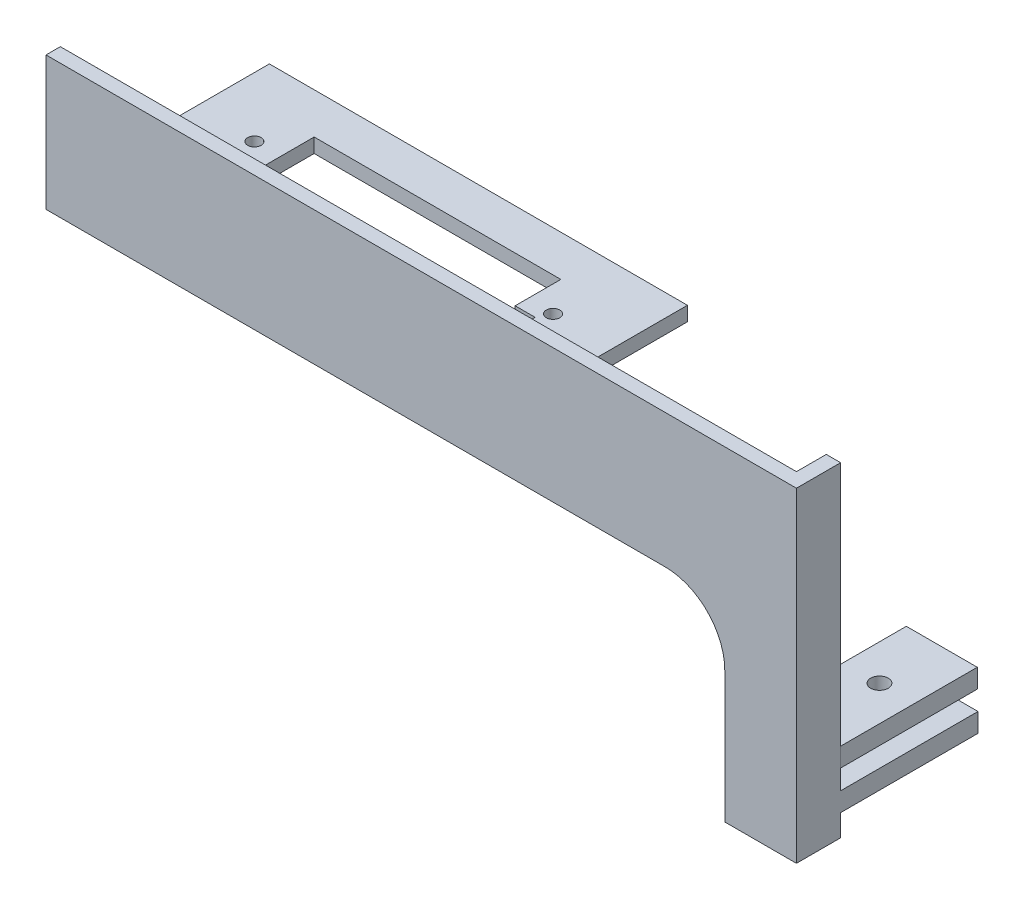
from build123d import *

# Parameters (mm, degrees)
SKETCH1_W               = 70
SKETCH1_H               = 35
BOSS_EXTRUDE1_DEPTH     = 2.4
SKETCH2_R               = 1.13
SKETCH2_W               = 40
SKETCH2_H               = 20
CUT_EXTRUDE1_DEPTH      = 2.4
SKETCH4_W               = 4
SKETCH4_H               = 6
CUT_EXTRUDE2_DEPTH      = 2.4
CUT_EXTRUDE3_DEPTH      = 134.373649476
CUT_EXTRUDE3_DEPTH_BACK = 134.373649476
SKETCH7_W               = 41.3
SKETCH7_H               = 21.3
SKETCH7_W_2             = 40
SKETCH7_H_2             = 20
BOSS_EXTRUDE2_DEPTH     = 2.4
SKETCH9_W               = 11.879910587
SKETCH9_H               = 3.175
SKETCH9_W_2             = 12
BOSS_EXTRUDE3_DEPTH     = 28
SKETCH10_R              = 1.4732
CUT_EXTRUDE4_DEPTH      = 30
FILLET1_R               = 10
SKETCH11_W              = 5
SKETCH11_H              = 54.4
BOSS_EXTRUDE4_DEPTH     = 2.4


with BuildPart() as part:
    # Sketch1 → Boss-Extrude1 (new body)
    with BuildSketch(Plane(origin=(0, 0, 0), x_dir=(1, 0, 0), z_dir=(0, 1, 0))):
        with Locations((92.522946176, 21.495750708)):
            Rectangle(SKETCH1_W, SKETCH1_H)
    extrude(amount=BOSS_EXTRUDE1_DEPTH)

    # Sketch2 → Cut-Extrude1 (cut)
    with BuildSketch(Plane(origin=(0, 2.4, 0), x_dir=(1, 0, 0), z_dir=(0, 1, 0))):
        with Locations(Location((67.522946176, 26.495750708, 0), (0, 0, 270))):
            Circle(SKETCH2_R)
        with Locations(Location((117.522946176, 26.495750708, 0), (0, 0, 270))):
            Circle(SKETCH2_R)
        with Locations(Location((117.522946176, 16.495750708, 0), (0, 0, 90))):
            Circle(SKETCH2_R)
        with Locations(Location((67.522946176, 16.495750708, 0), (0, 0, 90))):
            Circle(SKETCH2_R)
        with Locations((92.522946176, 21.495750708)):
            Rectangle(SKETCH2_W, SKETCH2_H)
    extrude(amount=-CUT_EXTRUDE1_DEPTH, mode=Mode.SUBTRACT)

    # Sketch4 → Cut-Extrude2 (cut)
    with BuildSketch(Plane(origin=(0, 2.4, 0), x_dir=(1, 0, 0), z_dir=(0, 1, 0))):
        with Locations((114.522946176, 21.495750708)):
            Rectangle(SKETCH4_W, SKETCH4_H)
    extrude(amount=-CUT_EXTRUDE2_DEPTH, mode=Mode.SUBTRACT)

    # Sketch7 → Cut-Extrude3 (cut, two sides: drawn at the far end of the back side and taken through both)
    with BuildSketch(Plane(origin=(0, 2.4, 0), x_dir=(1, 0, 0), z_dir=(0, 1, 0)).offset(-CUT_EXTRUDE3_DEPTH_BACK)):
        with Locations((92.522946176, 21.495750708)):
            Rectangle(SKETCH7_W, SKETCH7_H)
        with Locations((92.522946176, 21.495750708)):
            Rectangle(SKETCH7_W_2, SKETCH7_H_2, mode=Mode.SUBTRACT)
    extrude(amount=CUT_EXTRUDE3_DEPTH + CUT_EXTRUDE3_DEPTH_BACK, mode=Mode.SUBTRACT)

    # Sketch8 → Boss-Extrude2 (add)
    with BuildSketch(Plane.XY.offset(-3.995750708)):
        Polygon((57.522946176, 22.4), (183.172946176, 22.4), (183.172946176, -32), (171.172946176, -32), (171.172946176, 0), (57.522946176, 0), align=None)
    extrude(amount=BOSS_EXTRUDE2_DEPTH)

    # Sketch9 → Boss-Extrude3 (add)
    with BuildSketch(Plane(origin=(0, 0, -3.995750708), x_dir=(-1, 0, 0), z_dir=(0, 0, -1))):
        with Locations((-177.11290147, -20.4125)):
            Rectangle(SKETCH9_W, SKETCH9_H)
        with Locations((-177.172946176, -26.7625)):
            Rectangle(SKETCH9_W_2, SKETCH9_H)
    extrude(amount=BOSS_EXTRUDE3_DEPTH)

    # Sketch10 → Cut-Extrude4 (cut)
    with BuildSketch(Plane.XZ.offset(28.35)):
        with Locations(Location((177.172946176, -21.495750708, 0), (0, 0, 270))):
            Circle(SKETCH10_R)
    extrude(amount=-CUT_EXTRUDE4_DEPTH, mode=Mode.SUBTRACT)

    # Fillet1
    fillet1_edges = [part.edges().sort_by_distance(p)[0] for p in [
        (171.172946176, 0, -2.795750708),
    ]]
    fillet(fillet1_edges, radius=FILLET1_R)

    # Sketch11 → Boss-Extrude4 (add)
    with BuildSketch(Plane(origin=(183.172946176, 0, 0), x_dir=(0, 0, -1), z_dir=(1, 0, 0))):
        with Locations((6.495750708, -4.8)):
            Rectangle(SKETCH11_W, SKETCH11_H)
    extrude(amount=-BOSS_EXTRUDE4_DEPTH)


solid = part.part
